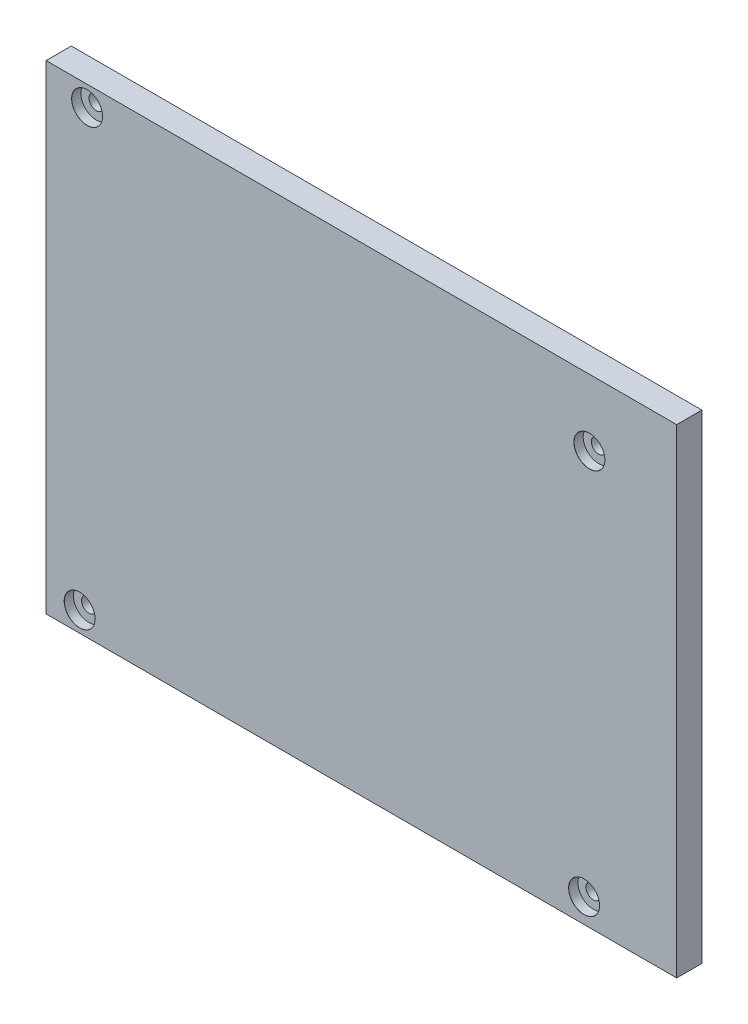
from build123d import *

# Parameters (mm, degrees)
SKETCH1_W                                   = 250
SKETCH1_H                                   = 190
BOSS_EXTRUDE1_DEPTH                         = 10
CBORE_FOR_M5_HEX_HEAD_CAP_SCREW1_AT_2_COUNT = 2
CBORE_FOR_M5_HEX_HEAD_CAP_SCREW1_AT_2_PITCH = 174.025024549
CBORE_FOR_M5_HEX_HEAD_CAP_SCREW1_AT_3_COUNT = 2
CBORE_FOR_M5_HEX_HEAD_CAP_SCREW1_AT_3_PITCH = 261.850395634
CBORE_FOR_M5_HEX_HEAD_CAP_SCREW1_AT_4_COUNT = 2
CBORE_FOR_M5_HEX_HEAD_CAP_SCREW1_AT_4_PITCH = 200


with BuildPart() as part:
    # Sketch1 → Boss-Extrude1 (new body)
    with BuildSketch(Plane.XY):
        with Locations((0, 8.452072107)):
            Rectangle(SKETCH1_W, SKETCH1_H)
    extrude(amount=BOSS_EXTRUDE1_DEPTH)

    # Sketch10 → CBORE for M5 Hex Head Cap Screw1 (revolve, cut)
    with BuildSketch(Plane(origin=(-108.749145678, 95.452072107, 10), x_dir=(0, -1, 0), z_dir=(1, 0, 0))):
        Polygon((0, 0), (0, 10), (2.9, 10), (2.9, 3.65), (6.12, 3.65), (6.12, 0.025), (6.145, 0), align=None)
    cbore_for_m5_hex_head_cap_screw1 = revolve(axis=Axis((-108.749145678, 95.452072107, 16.35), (0, 0, -1)), mode=Mode.SUBTRACT)

    # CBORE for M5 Hex Head Cap Screw1 at 2: CBORE for M5 Hex Head Cap Screw1 ×2
    with Locations(*[Vector(-0.01695807915079003, -0.9998562014367444, 0) * (i * CBORE_FOR_M5_HEX_HEAD_CAP_SCREW1_AT_2_PITCH) for i in range(1, CBORE_FOR_M5_HEX_HEAD_CAP_SCREW1_AT_2_COUNT)]):
        add(cbore_for_m5_hex_head_cap_screw1, mode=Mode.SUBTRACT)

    # CBORE for M5 Hex Head Cap Screw1 at 3: CBORE for M5 Hex Head Cap Screw1 ×2
    with Locations(*[Vector(0.7525017460823102, -0.6585902536046783, 0) * (i * CBORE_FOR_M5_HEX_HEAD_CAP_SCREW1_AT_3_PITCH) for i in range(1, CBORE_FOR_M5_HEX_HEAD_CAP_SCREW1_AT_3_COUNT)]):
        add(cbore_for_m5_hex_head_cap_screw1, mode=Mode.SUBTRACT)

    # CBORE for M5 Hex Head Cap Screw1 at 4: CBORE for M5 Hex Head Cap Screw1 ×2
    with Locations(*[Vector(0.9957709917740633, -0.09187019071112518, 0) * (i * CBORE_FOR_M5_HEX_HEAD_CAP_SCREW1_AT_4_PITCH) for i in range(1, CBORE_FOR_M5_HEX_HEAD_CAP_SCREW1_AT_4_COUNT)]):
        add(cbore_for_m5_hex_head_cap_screw1, mode=Mode.SUBTRACT)


solid = part.part
